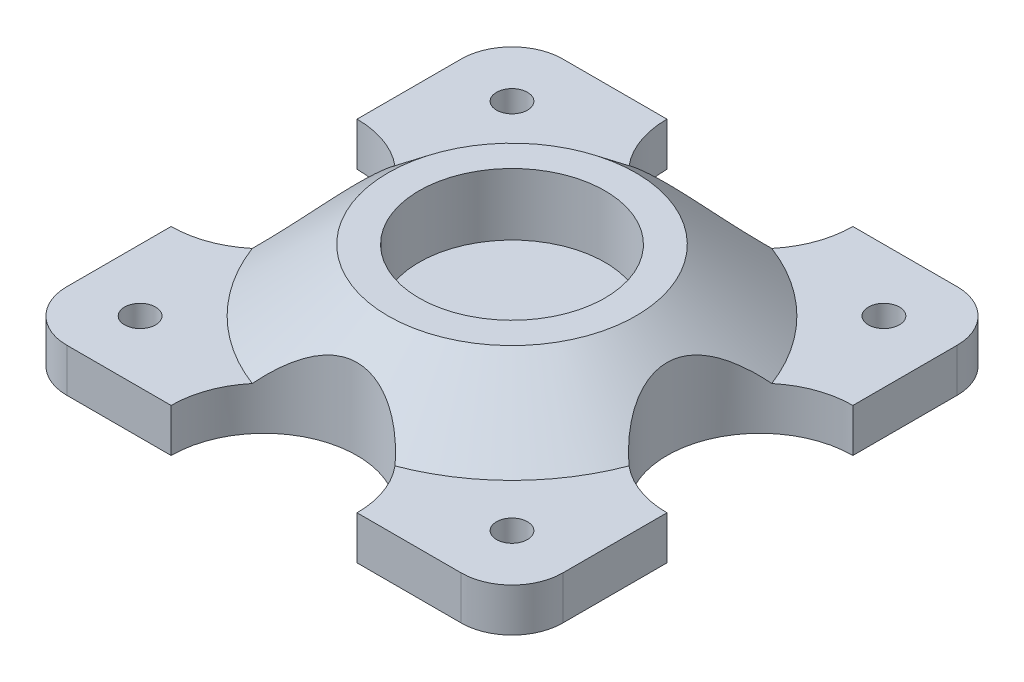
from build123d import *

# Parameters (mm, degrees)
SKETCH2_R           = 3.175
BOSS_EXTRUDE2_DEPTH = 8.89
SKETCH4_R           = 25.4
SKETCH4_R_2         = 19.05
BOSS_EXTRUDE3_DEPTH = 12.7
SKETCH4_3_R         = 41.275
SKETCH4_4_R         = 19.05
CUT_EXTRUDE1_DEPTH  = 73.955945628
CUT_EXTRUDE2_DEPTH  = 76.016052311


with BuildPart() as part:
    # Sketch2 → Boss-Extrude2 (new body)
    with BuildSketch(Plane(origin=(0, 0, 0), x_dir=(1, 0, 0), z_dir=(0, 1, 0))):
        with BuildLine():
            Line((-40.4, -50.8), (40.4, -50.8))
            ThreePointArc((40.4, -50.8), (47.753910524, -47.753910524), (50.8, -40.4))
            Line((50.8, -40.4), (50.8, 40.4))
            ThreePointArc((50.8, 40.4), (47.753910524, 47.753910524), (40.4, 50.8))
            Line((40.4, 50.8), (-40.4, 50.8))
            ThreePointArc((-40.4, 50.8), (-47.753910524, 47.753910524), (-50.8, 40.4))
            Line((-50.8, 40.4), (-50.8, -40.4))
            ThreePointArc((-50.8, -40.4), (-47.753910524, -47.753910524), (-40.4, -50.8))
        make_face()
        with Locations((-38.1, -38.1)):
            Circle(SKETCH2_R, mode=Mode.SUBTRACT)
        with Locations((38.1, -38.1)):
            Circle(SKETCH2_R, mode=Mode.SUBTRACT)
        with Locations((-38.1, 38.1)):
            Circle(SKETCH2_R, mode=Mode.SUBTRACT)
        with Locations((38.1, 38.1)):
            Circle(SKETCH2_R, mode=Mode.SUBTRACT)
    extrude(amount=BOSS_EXTRUDE2_DEPTH)

    # Sketch4 → Boss-Extrude3 (add)
    with BuildSketch(Plane(origin=(0, 8.89, 0), x_dir=(1, 0, 0), z_dir=(0, 1, 0))):
        Circle(SKETCH4_R)
        Circle(SKETCH4_R_2, mode=Mode.SUBTRACT)
    extrude(amount=BOSS_EXTRUDE3_DEPTH)

    # Sketch4<3> → section 1 of loft1
    with BuildSketch(Plane(origin=(0, 8.89, 0), x_dir=(1, 0, 0), z_dir=(0, 1, 0)), mode=Mode.PRIVATE) as loft1_s1:
        Circle(SKETCH4_3_R)
    # loft up to a face of the part (loft1)
    loft([Face(Wire([part.edges().sort_by_distance((-17.387496491, 21.59, -18.515803137))[0]])), loft1_s1.sketch])

    # Sketch4<4> → Cut-Extrude1 (cut, through all)
    with BuildSketch(Plane(origin=(0, 8.89, 0), x_dir=(1, 0, 0), z_dir=(0, 1, 0))):
        Circle(SKETCH4_4_R)
    extrude(amount=CUT_EXTRUDE1_DEPTH, mode=Mode.SUBTRACT)

    # Sketch2<3> → Cut-Extrude2 (cut, through all)
    with BuildSketch(Plane(origin=(0, 0, 0), x_dir=(1, 0, 0), z_dir=(0, 1, 0))):
        with BuildLine():
            Line((-19.05, -50.8), (19.05, -50.8))
            ThreePointArc((19.05, -50.8), (0, -31.75), (-19.05, -50.8))
        make_face()
        with BuildLine():
            ThreePointArc((50.8, 19.05), (31.75, 0), (50.8, -19.05))
            Line((50.8, -19.05), (50.8, 19.05))
        make_face()
        with BuildLine():
            Line((-50.8, 19.05), (-50.8, -19.05))
            ThreePointArc((-50.8, -19.05), (-31.75, 0), (-50.8, 19.05))
        make_face()
        with BuildLine():
            ThreePointArc((-19.05, 50.8), (0, 31.75), (19.05, 50.8))
            Line((19.05, 50.8), (-19.05, 50.8))
        make_face()
    extrude(amount=CUT_EXTRUDE2_DEPTH, mode=Mode.SUBTRACT)


solid = part.part
